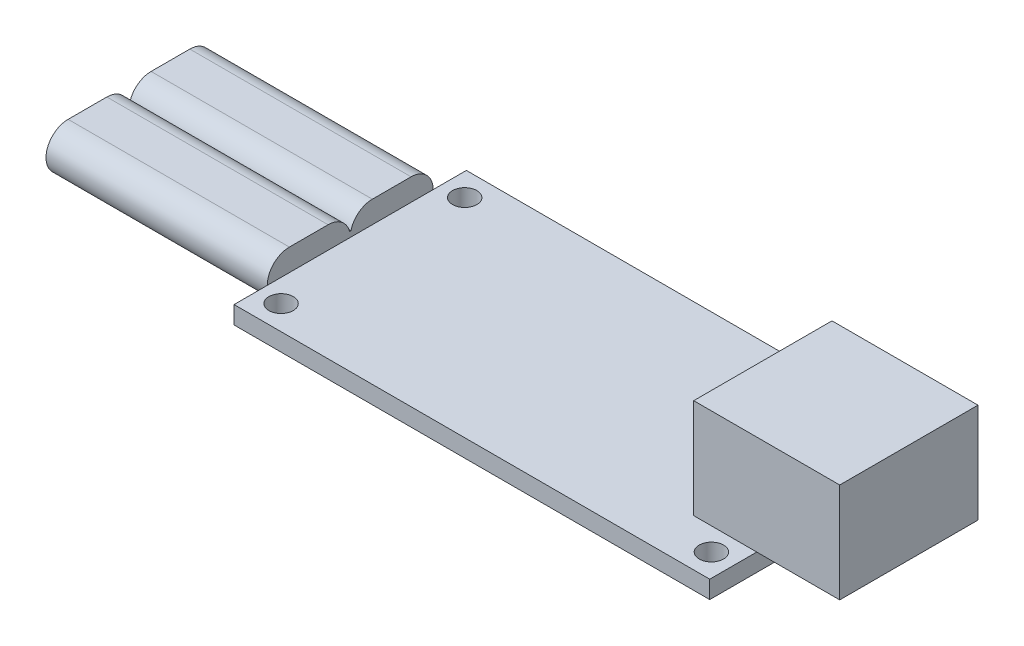
from build123d import *

# Parameters (mm, degrees)
SKETCH1_W           = 43
SKETCH1_H           = 21
SKETCH1_R           = 1.1
BOSS_EXTRUDE1_DEPTH = 1.6
BOSS_EXTRUDE2_DEPTH = 20
SKETCH3_W           = 13.2
SKETCH3_H           = 12.5
BOSS_EXTRUDE3_DEPTH = 9


with BuildPart() as part:
    # Sketch1 → Boss-Extrude1 (new body)
    with BuildSketch(Plane(origin=(0, 0, 0), x_dir=(1, 0, 0), z_dir=(0, 1, 0))):
        with Locations((21.5, 10.5)):
            Rectangle(SKETCH1_W, SKETCH1_H)
        with Locations(Location((2.05, 18.8, 0), (0, 0, 270))):
            Circle(SKETCH1_R, mode=Mode.SUBTRACT)
        with Locations(Location((40.95, 18.8, 0), (0, 0, 270))):
            Circle(SKETCH1_R, mode=Mode.SUBTRACT)
        with Locations(Location((40.95, 2.2, 0), (0, 0, 270))):
            Circle(SKETCH1_R, mode=Mode.SUBTRACT)
        with Locations(Location((2.05, 2.2, 0), (0, 0, 270))):
            Circle(SKETCH1_R, mode=Mode.SUBTRACT)
    extrude(amount=BOSS_EXTRUDE1_DEPTH)

    # Sketch2 → Boss-Extrude2 (add)
    with BuildSketch(Plane.ZY):
        with BuildLine():
            ThreePointArc((-16, 3.6), (-17.414213562, 3.014213562), (-18, 1.6))
            Line((-18, 1.6), (-11, 1.6))
            ThreePointArc((-11, 1.6), (-10.875, 1.930718914), (-10.5625, 2.096078371))
            ThreePointArc((-10.5625, 2.096078371), (-11.273655175, 3.179898215), (-12.5, 3.6))
            Line((-12.5, 3.6), (-16, 3.6))
        make_face()
        with BuildLine():
            Line((-17.2, 0), (-11.3, 0))
            ThreePointArc((-11.3, 0), (-10.836979464, 0.488981235), (-10.5625, 1.103921629))
            ThreePointArc((-10.5625, 1.103921629), (-10.875, 1.269281086), (-11, 1.6))
            Line((-11, 1.6), (-18, 1.6))
            ThreePointArc((-18, 1.6), (-17.788854382, 0.705572809), (-17.2, 0))
        make_face()
        with BuildLine():
            Line((-16, -0.4), (-12.5, -0.4))
            ThreePointArc((-12.5, -0.4), (-11.867544468, -0.297366596), (-11.3, 0))
            Line((-11.3, 0), (-17.2, 0))
            ThreePointArc((-17.2, 0), (-16.632455532, -0.297366596), (-16, -0.4))
        make_face()
        with BuildLine():
            ThreePointArc((-11, 1.6), (-10.875, 1.269281086), (-10.5625, 1.103921629))
            ThreePointArc((-10.5625, 1.103921629), (-10.515686517, 1.35), (-10.5, 1.6))
            Line((-10.5, 1.6), (-11, 1.6))
        make_face()
        with BuildLine():
            Line((-11, 1.6), (-10.5, 1.6))
            ThreePointArc((-10.5, 1.6), (-10.515686517, 1.85), (-10.5625, 2.096078371))
            ThreePointArc((-10.5625, 2.096078371), (-10.875, 1.930718914), (-11, 1.6))
        make_face()
        with BuildLine():
            ThreePointArc((-10.5, 1.6), (-10.515686517, 1.35), (-10.5625, 1.103921629))
            ThreePointArc((-10.5625, 1.103921629), (-10.5, 1.1), (-10.4375, 1.103921629))
            ThreePointArc((-10.4375, 1.103921629), (-10.484313483, 1.35), (-10.5, 1.6))
        make_face()
        with BuildLine():
            ThreePointArc((-10.5625, 2.096078371), (-10.515686517, 1.85), (-10.5, 1.6))
            ThreePointArc((-10.5, 1.6), (-10.484313483, 1.85), (-10.4375, 2.096078371))
            ThreePointArc((-10.4375, 2.096078371), (-10.5, 2.1), (-10.5625, 2.096078371))
        make_face()
        with BuildLine():
            Line((-10, 1.6), (-10.5, 1.6))
            ThreePointArc((-10.5, 1.6), (-10.484313483, 1.35), (-10.4375, 1.103921629))
            ThreePointArc((-10.4375, 1.103921629), (-10.125, 1.269281086), (-10, 1.6))
        make_face()
        with BuildLine():
            ThreePointArc((-10.4375, 2.096078371), (-10.484313483, 1.85), (-10.5, 1.6))
            Line((-10.5, 1.6), (-10, 1.6))
            ThreePointArc((-10, 1.6), (-10.125, 1.930718914), (-10.4375, 2.096078371))
        make_face()
        with BuildLine():
            ThreePointArc((-10.4375, 1.103921629), (-10.163020536, 0.488981235), (-9.7, 0))
            Line((-9.7, 0), (-3.8, 0))
            ThreePointArc((-3.8, 0), (-3.211145618, 0.705572809), (-3, 1.6))
            Line((-3, 1.6), (-10, 1.6))
            ThreePointArc((-10, 1.6), (-10.125, 1.269281086), (-10.4375, 1.103921629))
        make_face()
        with BuildLine():
            ThreePointArc((-8.5, 3.6), (-9.726344825, 3.179898215), (-10.4375, 2.096078371))
            ThreePointArc((-10.4375, 2.096078371), (-10.125, 1.930718914), (-10, 1.6))
            Line((-10, 1.6), (-3, 1.6))
            ThreePointArc((-3, 1.6), (-3.585786438, 3.014213562), (-5, 3.6))
            Line((-5, 3.6), (-8.5, 3.6))
        make_face()
        with BuildLine():
            Line((-3.8, 0), (-9.7, 0))
            ThreePointArc((-9.7, 0), (-9.132455532, -0.297366596), (-8.5, -0.4))
            Line((-8.5, -0.4), (-5, -0.4))
            ThreePointArc((-5, -0.4), (-4.367544468, -0.297366596), (-3.8, 0))
        make_face()
    extrude(amount=BOSS_EXTRUDE2_DEPTH)

    # Sketch3 → Boss-Extrude3 (add)
    with BuildSketch(Plane(origin=(0, 1.6, 0), x_dir=(1, 0, 0), z_dir=(0, 1, 0))):
        with Locations((43.9, 10.5)):
            Rectangle(SKETCH3_W, SKETCH3_H)
    extrude(amount=BOSS_EXTRUDE3_DEPTH)


solid = part.part
